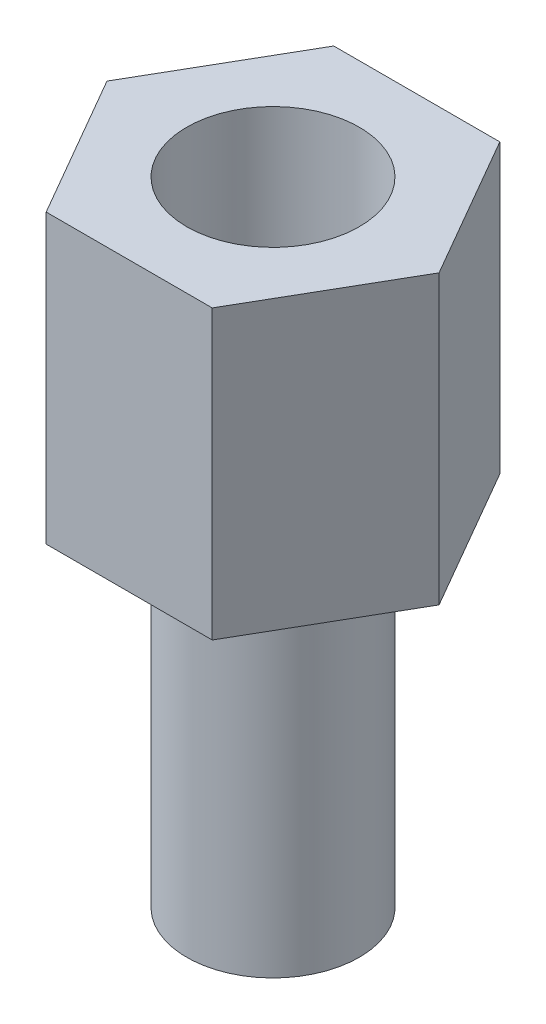
from build123d import *

# Parameters (mm, degrees)
CROQUIS1_R              = 1.5
SALIENTE_EXTRUIR1_DEPTH = 5
CROQUIS2_R              = 1.5
SALIENTE_EXTRUIR2_DEPTH = 6


with BuildPart() as part:
    # Croquis1 → Saliente-Extruir1 (new body)
    with BuildSketch(Plane(origin=(0, 0, 0), x_dir=(1, 0, 0), z_dir=(0, 1, 0))):
        Polygon((1.443375673, -2.5), (2.886751346, 0), (1.443375673, 2.5), (-1.443375673, 2.5), (-2.886751346, 0), (-1.443375673, -2.5), align=None)
        with Locations(Location((0, 0, 0), (0, 0, 270))):
            Circle(CROQUIS1_R, mode=Mode.SUBTRACT)
    extrude(amount=SALIENTE_EXTRUIR1_DEPTH)


with BuildPart() as body_2:
    # Croquis2 → Saliente-Extruir2 (new body)
    with BuildSketch(Plane.XZ):
        with Locations(Location((0, 0, 0), (0, 0, 270))):
            Circle(CROQUIS2_R)
    extrude(amount=SALIENTE_EXTRUIR2_DEPTH)


solid = Compound([part.part, body_2.part])
